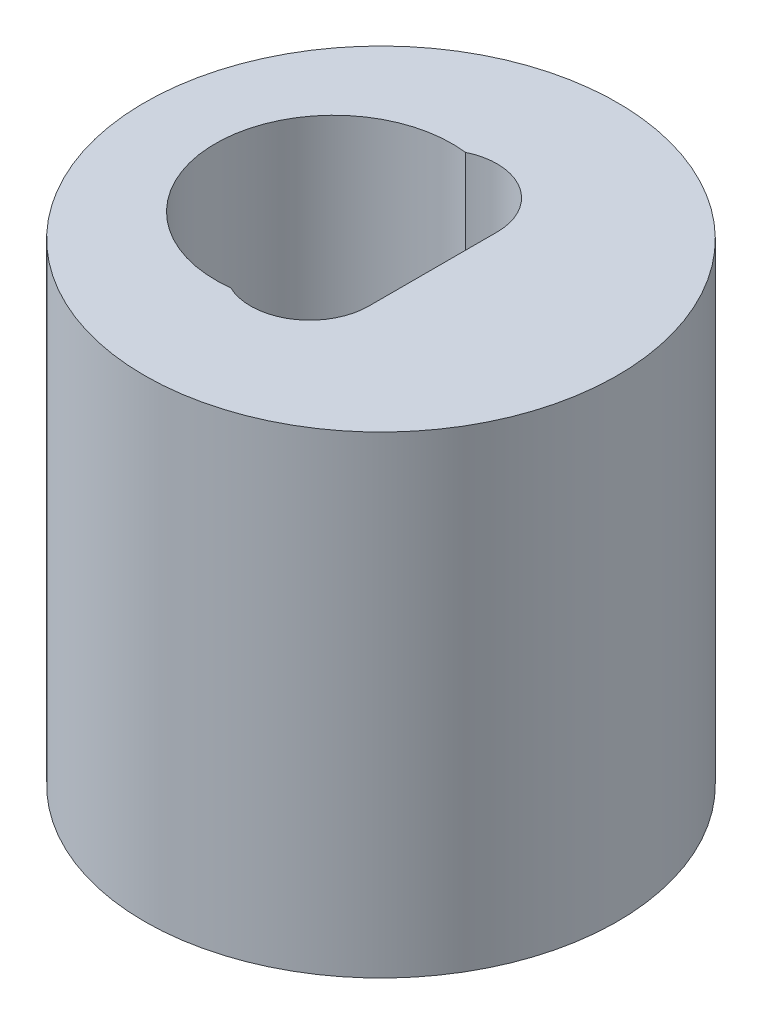
from build123d import *

# Parameters (mm, degrees)
SKETCH1_R           = 6.35
BOSS_EXTRUDE1_DEPTH = 12.7
CUT_EXTRUDE1_DEPTH  = 16.554259867


with BuildPart() as part:
    # Sketch1 → Boss-Extrude1 (new body)
    with BuildSketch(Plane(origin=(0, 0, 0), x_dir=(1, 0, 0), z_dir=(0, 1, 0))):
        with Locations(Location((0, 0, 0), (0, 0, 270))):
            Circle(SKETCH1_R)
        with BuildLine():
            Line((1.397, 1.722711816), (1.397, -1.722711816))
            ThreePointArc((1.397, -1.722711816), (-4.445, 0), (1.397, 1.722711816))
        make_face(mode=Mode.SUBTRACT)
    extrude(amount=BOSS_EXTRUDE1_DEPTH)

    # Sketch2 → Cut-Extrude1 (cut, through all)
    with BuildSketch(Plane(origin=(0, 12.7, 0), x_dir=(1, 0, 0), z_dir=(0, 1, 0))):
        with BuildLine():
            Line((-0.882804878, 3.151302102), (-0.882804878, -3.151302102))
            ThreePointArc((-0.882804878, -3.151302102), (0.65244788, -3.06792374), (1.397, -1.722711816))
            Line((1.397, -1.722711816), (1.397, 1.722711816))
            ThreePointArc((1.397, 1.722711816), (0.65244788, 3.06792374), (-0.882804878, 3.151302102))
        make_face()
    extrude(amount=-CUT_EXTRUDE1_DEPTH, mode=Mode.SUBTRACT)


solid = part.part
